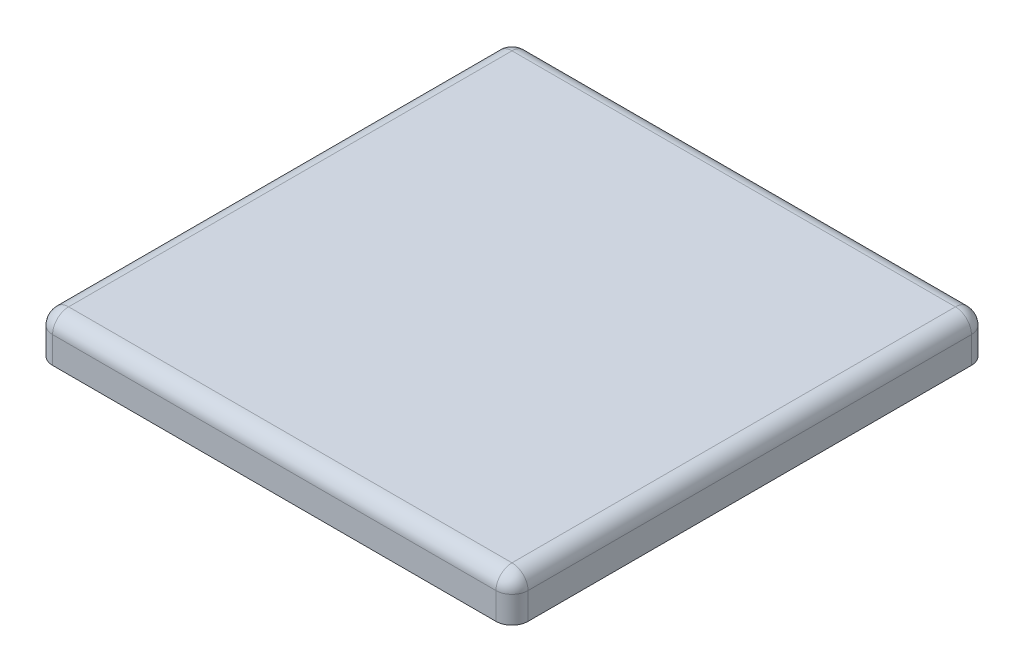
from build123d import *

# Parameters (mm, degrees)
SKETCH1_W           = 89
SKETCH1_H           = 89
BOSS_EXTRUDE1_DEPTH = 8
FILLET1_R           = 3
SHELL1_T            = -2


with BuildPart() as part:
    # Sketch1 → Boss-Extrude1 (new body)
    with BuildSketch(Plane(origin=(0, 0, 0), x_dir=(1, 0, 0), z_dir=(0, 1, 0))):
        Rectangle(SKETCH1_W, SKETCH1_H)
    extrude(amount=BOSS_EXTRUDE1_DEPTH)

    # Fillet1
    fillet1_edges = [part.edges().sort_by_distance(p)[0] for p in [
        (44.5, 8, 0),
        (0, 8, -44.5),
        (-44.5, 8, 0),
        (-44.5, 4, -44.5),
        (44.5, 4, -44.5),
        (44.5, 4, 44.5),
        (-44.5, 4, 44.5),
        (0, 8, 44.5),
    ]]
    fillet(fillet1_edges, radius=FILLET1_R)

    # Shell1
    shell1_openings = [part.faces().sort_by_distance(p)[0] for p in [
        (0, 0, 0),
    ]]
    offset(amount=SHELL1_T, openings=shell1_openings, kind=Kind.INTERSECTION)


solid = part.part
